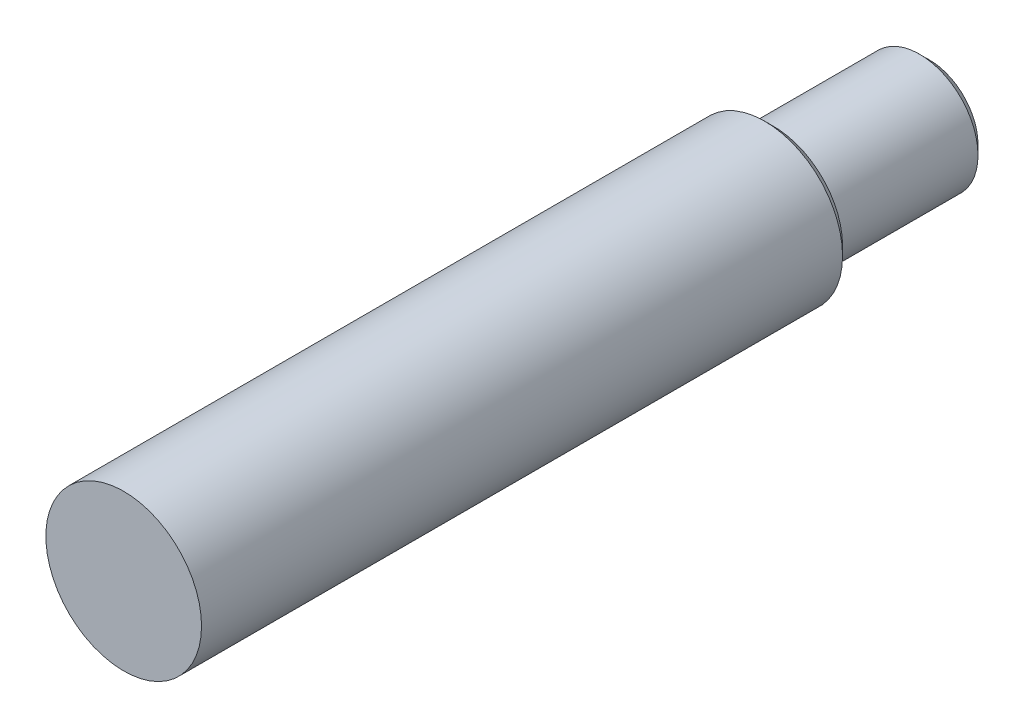
from build123d import *


with BuildPart() as part:
    # Sketch1 → Revolve1 (revolve)
    with BuildSketch(Plane(origin=(0, 0, 0), x_dir=(0, 0, -1), z_dir=(1, 0, 0))):
        Polygon((0, 0), (0, 4), (32.94, 4), (33.4, 3.54), (33.4, 3), (40.9, 3), (41.4, 2.5), (41.4, 0), align=None)
    revolve(axis=Axis((0, 0, -41.4), (0, 0, 1)))


solid = part.part
